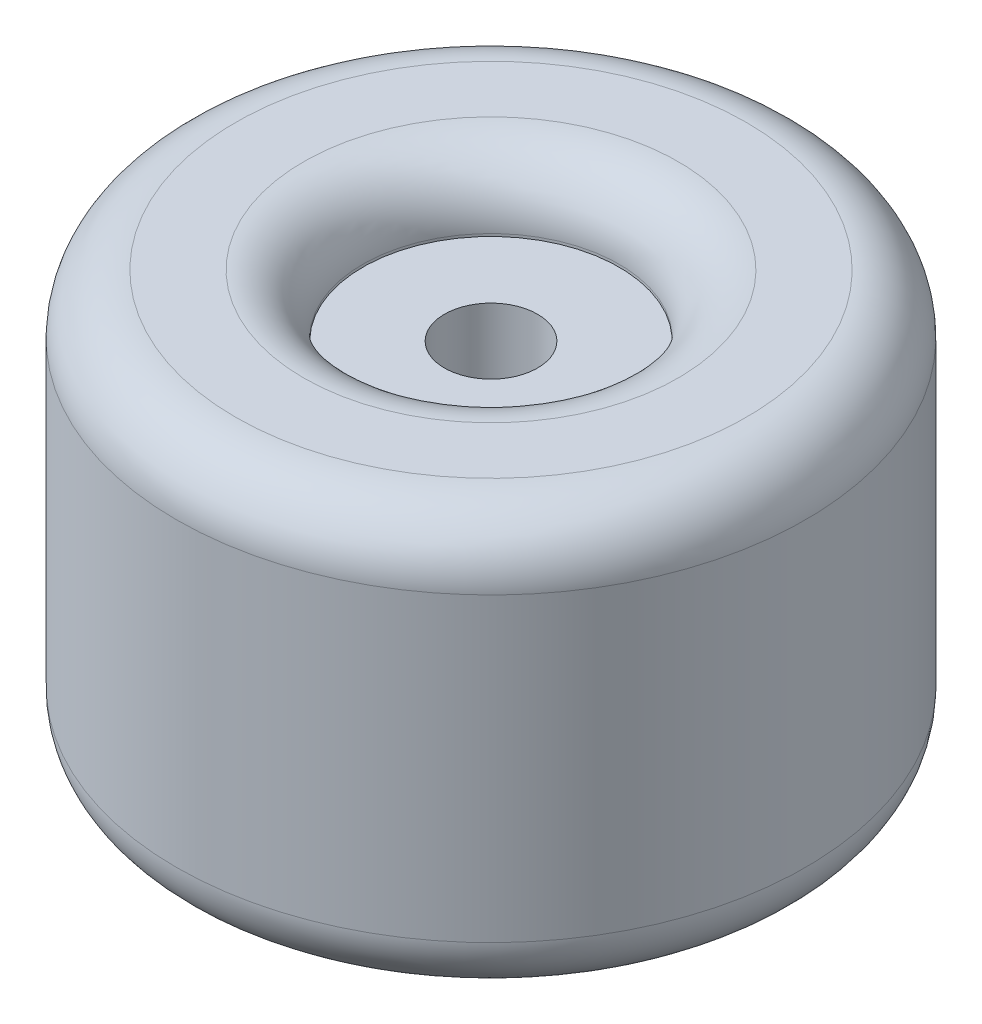
from build123d import *

# Parameters (mm, degrees)
SKETCH2_R          = 4
CUT_EXTRUDE1_DEPTH = 54.356


with BuildPart() as part:
    # Sketch1 → Revolve3 (revolve)
    with BuildSketch(Plane.XY, mode=Mode.PRIVATE) as revolve3_sk:
        with BuildLine():
            Line((0, 12.7), (0, -12.7))
            Line((0, -12.7), (11, -12.7))
            Line((11, -12.7), (11, -12.919434808))
            ThreePointArc((11, -12.919434808), (12.487804595, -16.511444297), (16.079737075, -17.999434801))
            Line((16.079737075, -17.999434801), (21.919737075, -17.999737061))
            ThreePointArc((21.919737075, -17.999737061), (25.512009489, -16.511932473), (27, -12.919737068))
            Line((27, -12.919737068), (27, 12.919737068))
            ThreePointArc((27, 12.919737068), (25.512009489, 16.511932473), (21.919737075, 17.999737061))
            Line((21.919737075, 17.999737061), (16.079737075, 17.999434801))
            ThreePointArc((16.079737075, 17.999434801), (12.487804595, 16.511444297), (11, 12.919434808))
            Line((11, 12.919434808), (11, 12.7))
            Line((11, 12.7), (0, 12.7))
        make_face()
    revolve(revolve3_sk.sketch.rotate(Axis((0, 12.7, 0), (0, -1, 0)), 90), axis=Axis((0, 12.7, 0), (0, -1, 0)))

    # Sketch2 → Cut-Extrude1 (cut)
    with BuildSketch(Plane.XZ.offset(12.7)):
        with Locations(Location((0, 0, 0), (0, 0, 270))):
            Circle(SKETCH2_R)
    extrude(amount=-CUT_EXTRUDE1_DEPTH, mode=Mode.SUBTRACT)


solid = part.part
